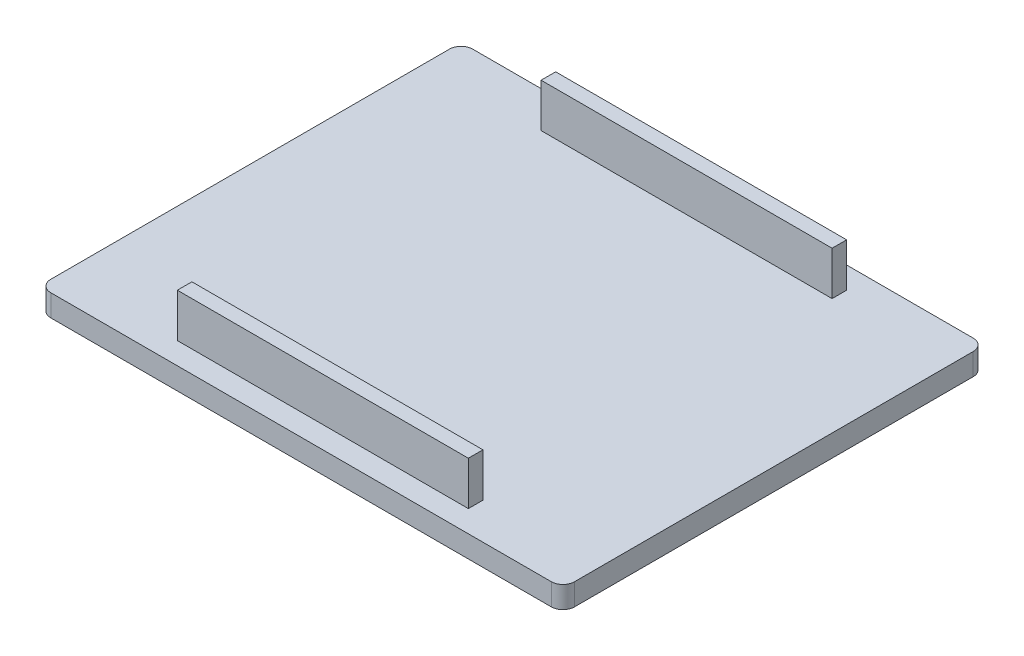
from build123d import *

# Parameters (mm, degrees)
SKETCH1_W           = 36
SKETCH1_H           = 29
BOSS_EXTRUDE1_DEPTH = 1.5
FILLET1_R           = 0.8
SKETCH2_W           = 20
SKETCH2_H           = 1
BOSS_EXTRUDE2_DEPTH = 3


with BuildPart() as part:
    # Sketch1 → Boss-Extrude1 (new body)
    with BuildSketch(Plane(origin=(0, 0, 0), x_dir=(1, 0, 0), z_dir=(0, 1, 0))):
        with Locations((18, -14.5)):
            Rectangle(SKETCH1_W, SKETCH1_H)
    extrude(amount=BOSS_EXTRUDE1_DEPTH)

    # Fillet1
    fillet1_edges = [part.edges().sort_by_distance(p)[0] for p in [
        (0, 0.75, 0),
        (36, 0.75, 0),
        (36, 0.75, 29),
        (0, 0.75, 29),
    ]]
    fillet(fillet1_edges, radius=FILLET1_R)

    # Sketch2 → Boss-Extrude2 (add)
    with BuildSketch(Plane(origin=(0, 1.5, 0), x_dir=(1, 0, 0), z_dir=(0, 1, 0))):
        with Locations((18, -2)):
            Rectangle(SKETCH2_W, SKETCH2_H)
        with Locations((18, -27)):
            Rectangle(SKETCH2_W, SKETCH2_H)
    extrude(amount=BOSS_EXTRUDE2_DEPTH)


solid = part.part
